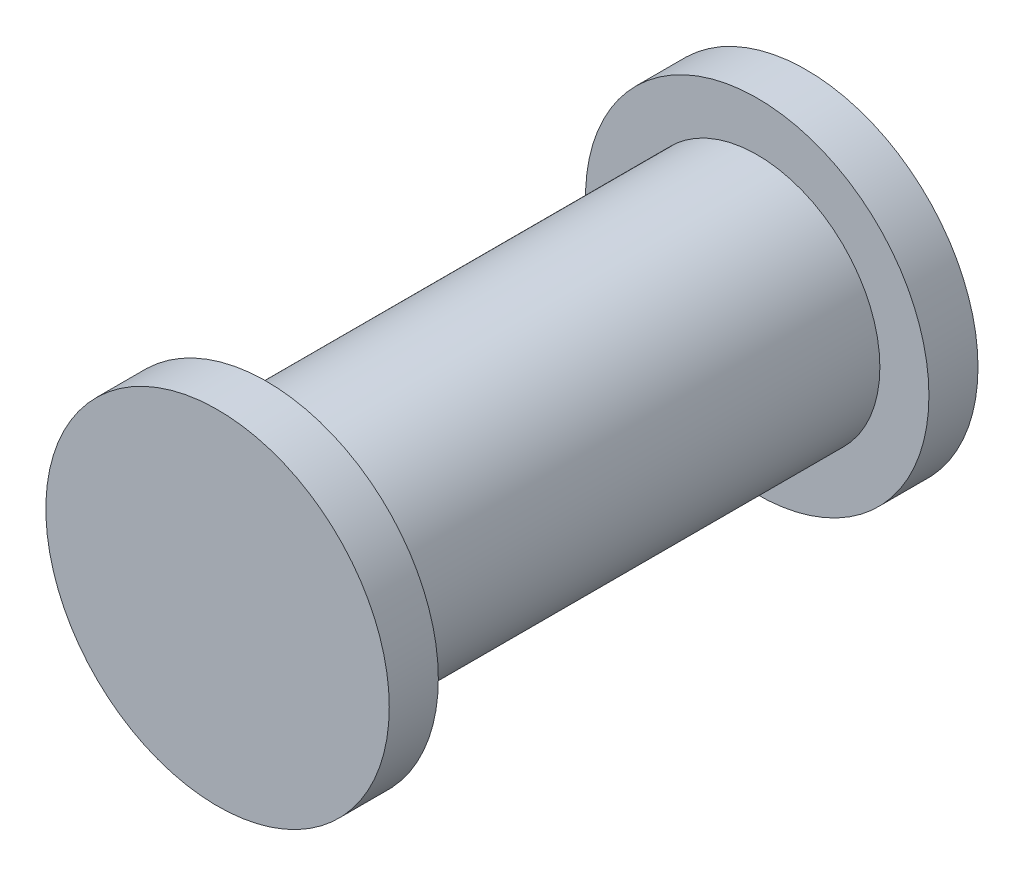
from build123d import *

# Parameters (mm, degrees)
SKETCH1_R           = 25
BOSS_EXTRUDE1_DEPTH = 100
SKETCH2_R           = 35
BOSS_EXTRUDE2_DEPTH = 10


with BuildPart() as part:
    # Sketch1 → Boss-Extrude1 (new body)
    with BuildSketch(Plane.XY):
        Circle(SKETCH1_R)
    extrude(amount=BOSS_EXTRUDE1_DEPTH)

    # Sketch2 → Boss-Extrude2 (add)
    with BuildSketch(Plane.XY.offset(100)):
        Circle(SKETCH2_R)
    boss_extrude2 = extrude(amount=BOSS_EXTRUDE2_DEPTH)

    # Mirror1: Boss-Extrude2 across plane
    add(boss_extrude2.mirror(Plane(origin=(0, 0, 50), x_dir=(1, 0, 0), z_dir=(0, 0, -1))))


solid = part.part
